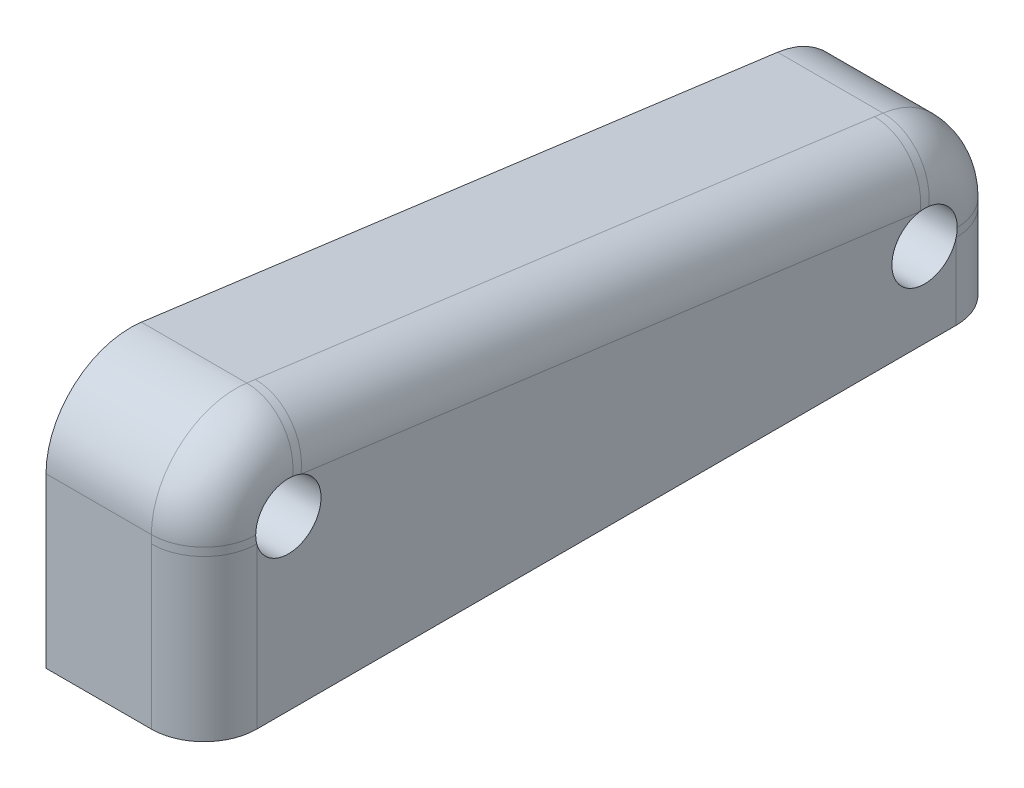
from build123d import *

# Parameters (mm, degrees)
ESQUISSE1_R             = 3.1
BOSS_EXTRU_1_DEPTH      = 15
CONG_1_R                = 8
CONG_2_R                = 5
ENL_V_MAT_EXTRU_1_DEPTH = 10


with BuildPart() as part:
    # Esquisse1 → Boss.-Extru.1 (new body)
    with BuildSketch(Plane(origin=(0, 0, 0), x_dir=(0, 0, -1), z_dir=(1, 0, 0))):
        Polygon((0, 0), (-76.372261843, 0), (-76.372261843, 25.120178971), (0, 15), align=None)
        with Locations((-68.372261843, 16)):
            Circle(ESQUISSE1_R, mode=Mode.SUBTRACT)
        with Locations((-8, 8)):
            Circle(ESQUISSE1_R, mode=Mode.SUBTRACT)
    extrude(amount=BOSS_EXTRU_1_DEPTH)

    # Congé1
    cong_1_edges = [part.edges().sort_by_distance(p)[0] for p in [
        (7.5, 25.120178971, 76.372261843),
        (7.5, 15, 0),
    ]]
    fillet(cong_1_edges, radius=CONG_1_R)

    # Congé2
    cong_2_edges = [part.edges().sort_by_distance(p)[0] for p in [
        (15, 3.995079138, 0),
        (15, 7.995079138, 76.372261843),
        (15, 19.920833067, 37.135227801),
    ]]
    fillet(cong_2_edges, radius=CONG_2_R)

    # Esquisse2 → Enlèv. mat.-Extru.1 (cut)
    with BuildSketch(Plane.ZY):
        with BuildLine():
            ThreePointArc((60.51684394, 17.97545174), (63.038081045, 9.904385575), (71.372261843, 8.476038278))
            Line((71.372261843, 8.476038278), (71.372261843, 5))
            Line((71.372261843, 5), (15.523961722, 5))
            ThreePointArc((15.523961722, 5), (16.082776909, 8.52793697), (15.069803831, 11.953210568))
            Line((15.069803831, 11.953210568), (60.51684394, 17.97545174))
        make_face()
    extrude(amount=-ENL_V_MAT_EXTRU_1_DEPTH, mode=Mode.SUBTRACT)


solid = part.part
